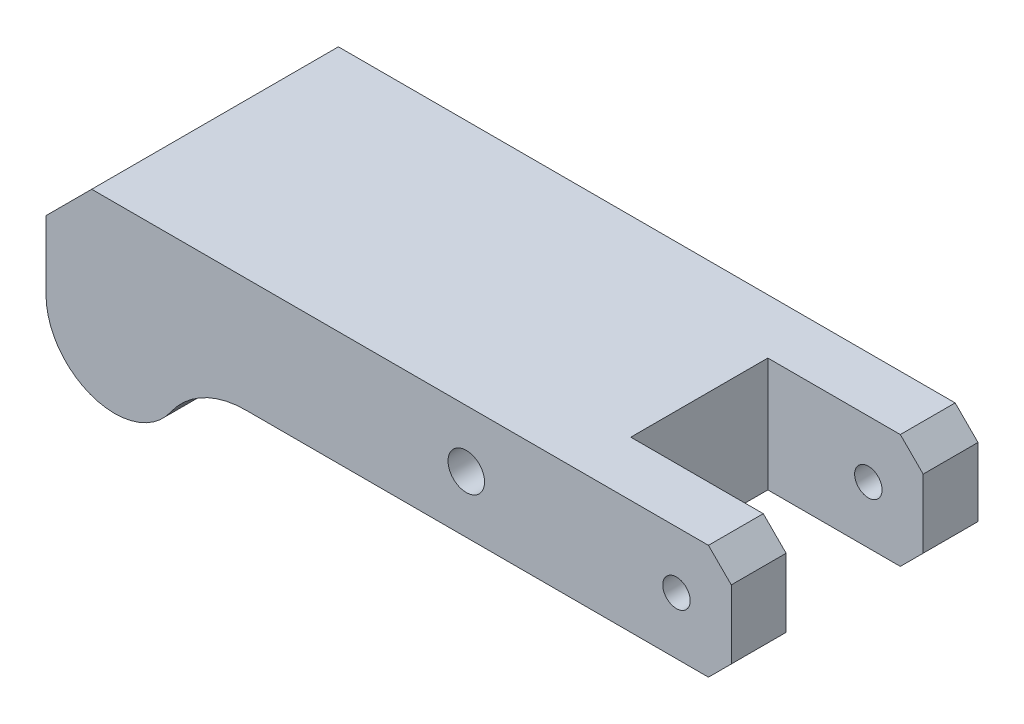
from build123d import *

# Parameters (mm, degrees)
SKETCH1_R           = 4
SKETCH1_R_2         = 3
BOSS_EXTRUDE1_DEPTH = 54
CHAMFER1_SIZE       = 5
CHAMFER2_SIZE       = 10
SKETCH2_W           = 5
SKETCH2_H           = 30
SKETCH2_W_2         = 29
CUT_EXTRUDE2_DEPTH  = 165.36544649


with BuildPart() as part:
    # Sketch1 → Boss-Extrude1 (new body)
    with BuildSketch(Plane.XY):
        with BuildLine():
            Line((43.722813233, 0), (150, 0))
            Line((150, 0), (150, 25))
            Line((150, 25), (0, 25))
            Line((0, 25), (0, 0))
            ThreePointArc((0, 0), (10.508154972, -14.311650088), (27.3097771, -8.571428571))
            ThreePointArc((27.3097771, -8.571428571), (34.464612235, -2.271894791), (43.722813233, 0))
        make_face()
        with Locations((92, 12.5)):
            Circle(SKETCH1_R, mode=Mode.SUBTRACT)
        with Locations((138, 12.5)):
            Circle(SKETCH1_R_2, mode=Mode.SUBTRACT)
    extrude(amount=BOSS_EXTRUDE1_DEPTH)

    # Chamfer1
    chamfer1_edges = [part.edges().sort_by_distance(p)[0] for p in [
        (150, 25, 27),
        (150, 0, 27),
    ]]
    chamfer(chamfer1_edges, length=CHAMFER1_SIZE)

    # Chamfer2
    chamfer2_edges = [part.edges().sort_by_distance(p)[0] for p in [
        (0, 25, 27),
    ]]
    chamfer(chamfer2_edges, length=CHAMFER2_SIZE)

    # Sketch2 → Cut-Extrude2 (cut, through all)
    with BuildSketch(Plane(origin=(0, 25, 0), x_dir=(1, 0, 0), z_dir=(0, 1, 0))):
        with Locations((147.5, -27)):
            Rectangle(SKETCH2_W, SKETCH2_H)
        with Locations((130.5, -27)):
            Rectangle(SKETCH2_W_2, SKETCH2_H)
    extrude(amount=-CUT_EXTRUDE2_DEPTH, mode=Mode.SUBTRACT)


solid = part.part
